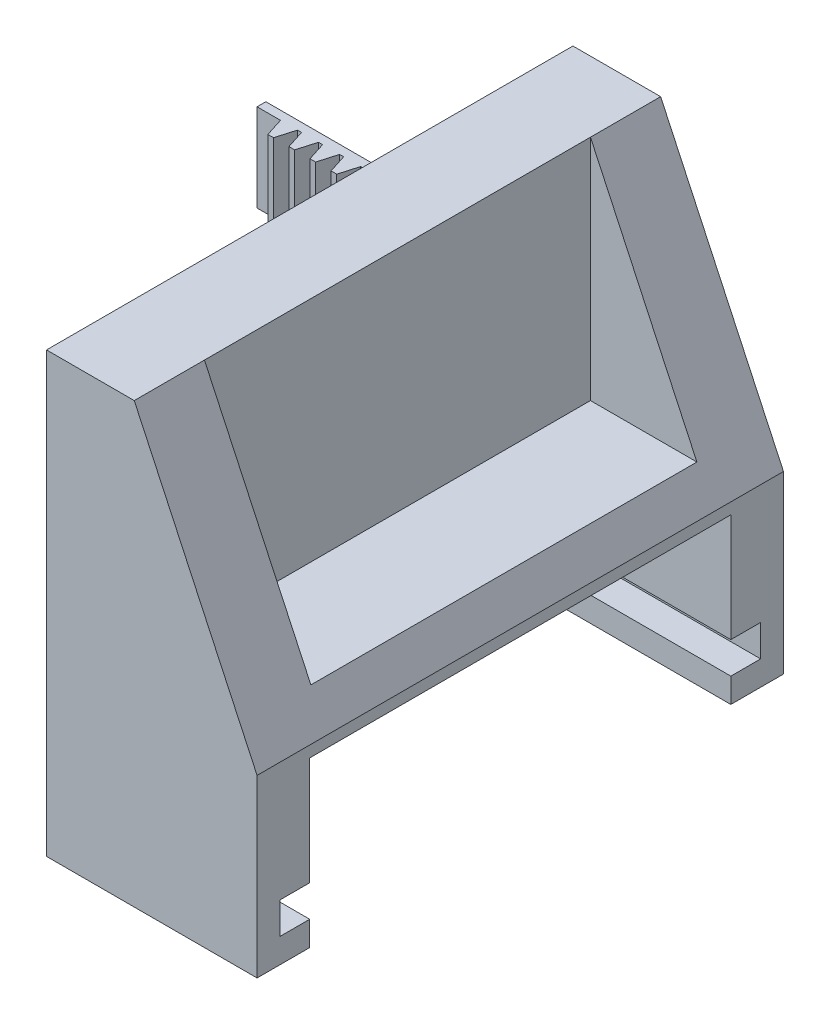
from build123d import *

# Parameters (mm, degrees)
BOSS_EXTRUDE1_DEPTH = 30
SKETCH4_W           = 24
SKETCH4_H           = 14
CUT_EXTRUDE2_DEPTH  = 25
SKETCH5_W           = 1.7
SKETCH5_H           = 1.8
CUT_EXTRUDE3_DEPTH  = 15
CUT_EXTRUDE4_DEPTH  = 11
BOSS_EXTRUDE2_DEPTH = 5


with BuildPart() as part:
    # Sketch1 → Boss-Extrude1 (new body)
    with BuildSketch(Plane.XY):
        Polygon((0, 0), (0, -25), (12, -25), (12, -15), (5, 0), align=None)
    extrude(amount=-BOSS_EXTRUDE1_DEPTH)

    # Sketch4 → Cut-Extrude2 (cut)
    with BuildSketch(Plane.ZY):
        with Locations((-15, -22.638599401)):
            Rectangle(SKETCH4_W, SKETCH4_H)
    extrude(amount=-CUT_EXTRUDE2_DEPTH, mode=Mode.SUBTRACT)

    # Sketch5 → Cut-Extrude3 (cut)
    with BuildSketch(Plane.ZY):
        with Locations((-2.15, -22.7)):
            Rectangle(SKETCH5_W, SKETCH5_H)
    cut_extrude3 = extrude(amount=-CUT_EXTRUDE3_DEPTH, mode=Mode.SUBTRACT)

    # Mirror1: Cut-Extrude3 across plane
    add(cut_extrude3.mirror(Plane.XY.offset(-15)), mode=Mode.SUBTRACT)

    # Sketch6 → Cut-Extrude4 (cut, symmetric)
    with BuildSketch(Plane.XY.offset(-15)):
        Polygon((5, 0), (5, -13), (11.066666667, -13), align=None)
    extrude(amount=CUT_EXTRUDE4_DEPTH, both=True, mode=Mode.SUBTRACT)

    # Sketch7 → Boss-Extrude2 (add)
    with BuildSketch(Plane(origin=(0, -15, 0), x_dir=(1, 0, 0), z_dir=(0, 1, 0))):
        Polygon((0, 28.5), (-16, 28.5), (-16, 28), (-14.9, 28), (-14.665549599, 28), (-14.327251213, 26.943471152), (-14.004330027, 26.943471152), (-13.7, 28), (-13.465549599, 28), (-13.127251213, 26.943471152), (-12.804330027, 26.943471152), (-12.5, 28), (-12.265549599, 28), (-11.927251213, 26.943471152), (-11.604330027, 26.943471152), (-11.3, 28), (-11.065549599, 28), (-10.727251213, 26.943471152), (-10.404330027, 26.943471152), (-10.1, 28), (-9.865549599, 28), (-9.527251213, 26.943471152), (-9.204330027, 26.943471152), (-8.9, 28), (-8.665549599, 28), (-8.327251213, 26.943471152), (-8.004330027, 26.943471152), (-7.7, 28), (-7.465549599, 28), (-7.127251213, 26.943471152), (-6.804330027, 26.943471152), (-6.5, 28), (-6.265549599, 28), (-5.927251213, 26.943471152), (-5.604330027, 26.943471152), (-5.3, 28), (-5.065549599, 28), (-4.727251213, 26.943471152), (-4.404330027, 26.943471152), (-4.1, 28), (-3.865549599, 28), (-3.527251213, 26.943471152), (-3.204330027, 26.943471152), (-2.9, 28), (-2.665549599, 28), (-2.327251213, 26.943471152), (-2.004330027, 26.943471152), (-1.7, 28), (-1.465549599, 28), (-1.127251213, 26.943471152), (-0.804330027, 26.943471152), (-0.5, 28), (0, 28), align=None)
    extrude(amount=BOSS_EXTRUDE2_DEPTH)


solid = part.part
